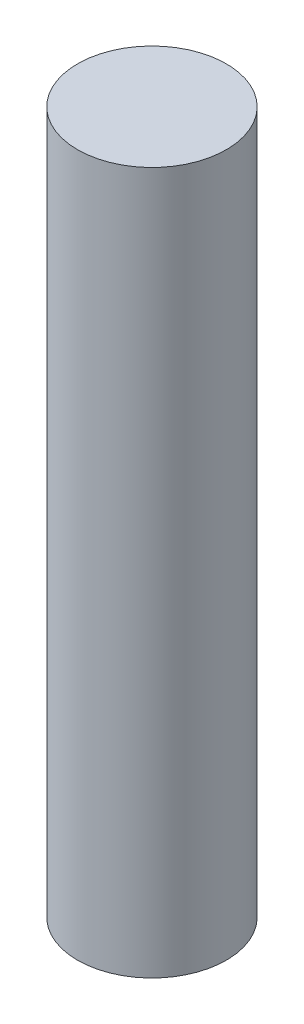
from build123d import *

# Parameters (mm, degrees)
SKETCH1_R           = 2.6924
BOSS_EXTRUDE1_DEPTH = 25.4


with BuildPart() as part:
    # Sketch1 → Boss-Extrude1 (new body)
    with BuildSketch(Plane(origin=(0, 0, 0), x_dir=(1, 0, 0), z_dir=(0, 1, 0))):
        with Locations(Location((-3.731591213, 8.188769606, 0), (0, 0, 270))):
            Circle(SKETCH1_R)
    extrude(amount=BOSS_EXTRUDE1_DEPTH)


solid = part.part
